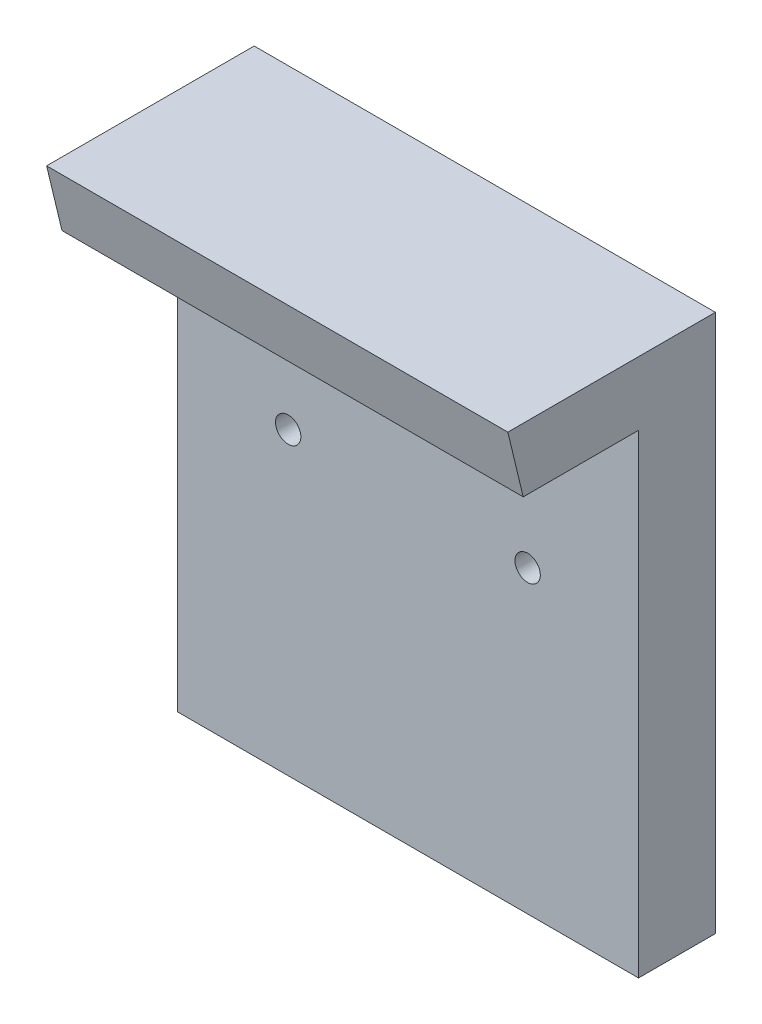
from build123d import *

# Parameters (mm, degrees)
ESQUISSE1_W           = 60
ESQUISSE1_H           = 70
BOSS_EXTRU_1_DEPTH    = 10
BOSS_EXTRU_2_DEPTH    = 60
TROU_TARAUD_M41_D     = 3.3
TROU_TARAUD_M41_DEPTH = 11.5
TROU_TARAUD_M41_TIP   = 0.991420021


with BuildPart() as part:
    # Esquisse1 → Boss.-Extru.1 (new body)
    with BuildSketch(Plane.XY):
        with Locations((3.076402568, -15.684931507)):
            Rectangle(ESQUISSE1_W, ESQUISSE1_H)
    extrude(amount=BOSS_EXTRU_1_DEPTH)

    # Esquisse2 → Boss.-Extru.2 (add)
    with BuildSketch(Plane(origin=(33.076402568, 0, 0), x_dir=(0, 0, -1), z_dir=(1, 0, 0))):
        Polygon((-27, 19.315068493), (-25, 11.018826061), (-10, 11.018826061), (-10, 19.315068493), align=None)
    extrude(amount=-BOSS_EXTRU_2_DEPTH)

    # Trou taraudé M41
    with Locations(Plane(origin=(18.651402568, -11.684931507, 0), x_dir=(-1, 0, 0), z_dir=(0, 0, -1))):
        with Locations((0, 0), (31.15, 0)):
            Hole(TROU_TARAUD_M41_D / 2, depth=TROU_TARAUD_M41_DEPTH)
            with Locations((0, 0, -(TROU_TARAUD_M41_DEPTH + TROU_TARAUD_M41_TIP / 2))):  # 118° drill point
                Cone(0, TROU_TARAUD_M41_D / 2, TROU_TARAUD_M41_TIP, mode=Mode.SUBTRACT)


solid = part.part
